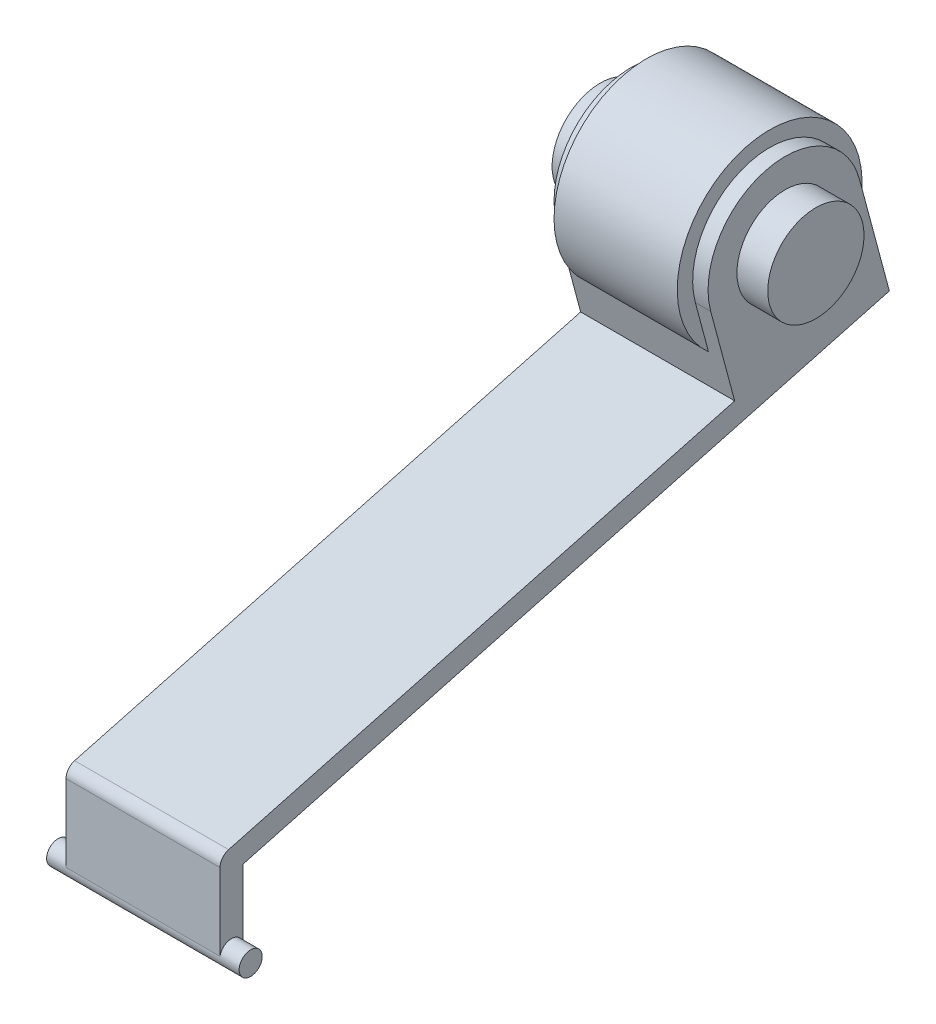
from build123d import *

# Parameters (mm, degrees)
SKETCH1_R                = 0.3
BOSS_EXTRUDE1_DEPTH      = 2.5
BOSS_EXTRUDE2_DEPTH      = 2
BOSS_EXTRUDE2_DEPTH_BACK = 2
BOSS_EXTRUDE3_DEPTH      = 4
BOSS_EXTRUDE4_DEPTH      = 1.6
BOSS_EXTRUDE4_DEPTH_BACK = 1.6
SKETCH5_R                = 2.4
BOSS_EXTRUDE5_DEPTH      = 2.8
BOSS_EXTRUDE5_DEPTH_BACK = 2.8
SKETCH6_R                = 1.25


with BuildPart() as part:
    # Sketch1 → Boss-Extrude1 (new, symmetric)
    with BuildSketch(Plane(origin=(0, 0, 0), x_dir=(0, 0, -1), z_dir=(1, 0, 0))):
        Circle(SKETCH1_R)
    extrude(amount=BOSS_EXTRUDE1_DEPTH, both=True)

    # Sketch2 → Boss-Extrude2 (add, two sides: drawn at the far end of the back side and taken through both)
    with BuildSketch(Plane(origin=(0, 0, 0), x_dir=(0, 0, -1), z_dir=(1, 0, 0)).offset(-BOSS_EXTRUDE2_DEPTH_BACK)):
        with BuildLine():
            Line((-0.296211166, 0.047528362), (-0.296211166, 2.047528362))
            ThreePointArc((-0.296211166, 2.047528362), (-0.233869415, 2.231181239), (-0.07260959, 2.338931609))
            Line((-0.07260959, 2.338931609), (15, 6.377625177))
            Line((15, 6.377625177), (15.153330182, 5.805389146))
            Line((15.153330182, 5.805389146), (0.296211166, 1.824436104))
            Line((0.296211166, 1.824436104), (0.296211166, 0.047528362))
            Line((0.296211166, 0.047528362), (-0.296211166, 0.047528362))
        make_face()
    extrude(amount=BOSS_EXTRUDE2_DEPTH + BOSS_EXTRUDE2_DEPTH_BACK)

    # Sketch4 → Boss-Extrude3 (add)
    with BuildSketch(Plane(origin=(2, 0, 0), x_dir=(0, 0, -1), z_dir=(1, 0, 0))):
        with BuildLine():
            Line((13.22147853, 5.287751056), (17.085181835, 6.323027237))
            Line((17.085181835, 6.323027237), (16.308724699, 9.220804715))
            ThreePointArc((16.308724699, 9.220804715), (13.859234957, 10.635018278), (12.445021394, 8.185528535))
            Line((12.445021394, 8.185528535), (13.22147853, 5.287751056))
        make_face()
    extrude(amount=-BOSS_EXTRUDE3_DEPTH)

    # Sketch5 → Boss-Extrude4 (add, two sides: drawn at the far end of the back side and taken through both)
    with BuildSketch(Plane(origin=(0, 0, 0), x_dir=(0, 0, -1), z_dir=(1, 0, 0)).offset(-BOSS_EXTRUDE4_DEPTH_BACK)):
        with Locations((14.376873047, 8.703166625)):
            Circle(SKETCH5_R)
    extrude(amount=BOSS_EXTRUDE4_DEPTH + BOSS_EXTRUDE4_DEPTH_BACK)

    # Sketch6 → Boss-Extrude5 (add, two sides: drawn at the far end of the back side and taken through both)
    with BuildSketch(Plane(origin=(0, 0, 0), x_dir=(0, 0, -1), z_dir=(1, 0, 0)).offset(-BOSS_EXTRUDE5_DEPTH_BACK)):
        with Locations((14.376873047, 8.703166625)):
            Circle(SKETCH6_R)
    extrude(amount=BOSS_EXTRUDE5_DEPTH + BOSS_EXTRUDE5_DEPTH_BACK)


solid = part.part
